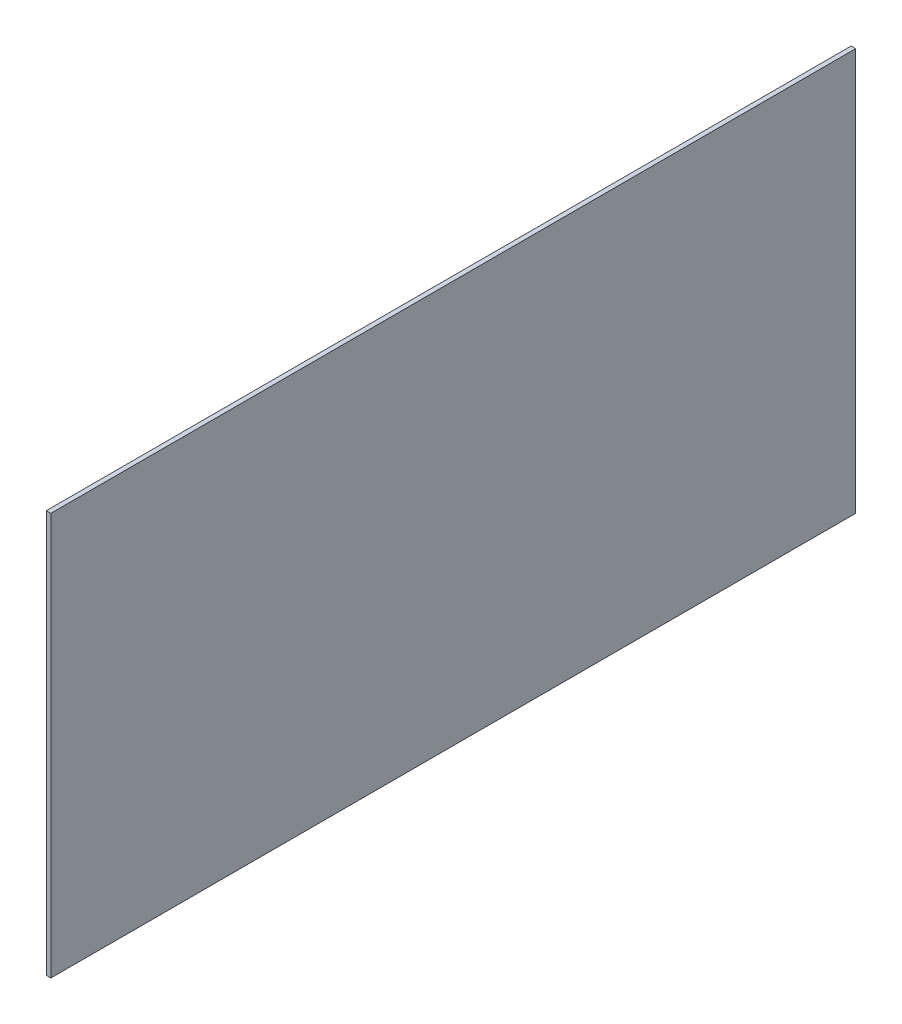
from build123d import *

# Parameters (mm, degrees)
SKETCH1_W           = 279.4
SKETCH1_H           = 139.7
BOSS_EXTRUDE1_DEPTH = 1.5875


with BuildPart() as part:
    # Sketch1 → Boss-Extrude1 (new body)
    with BuildSketch(Plane(origin=(0, 0, 0), x_dir=(0, 0, -1), z_dir=(1, 0, 0))):
        with Locations((139.7, 69.85)):
            Rectangle(SKETCH1_W, SKETCH1_H)
    extrude(amount=BOSS_EXTRUDE1_DEPTH)


solid = part.part
